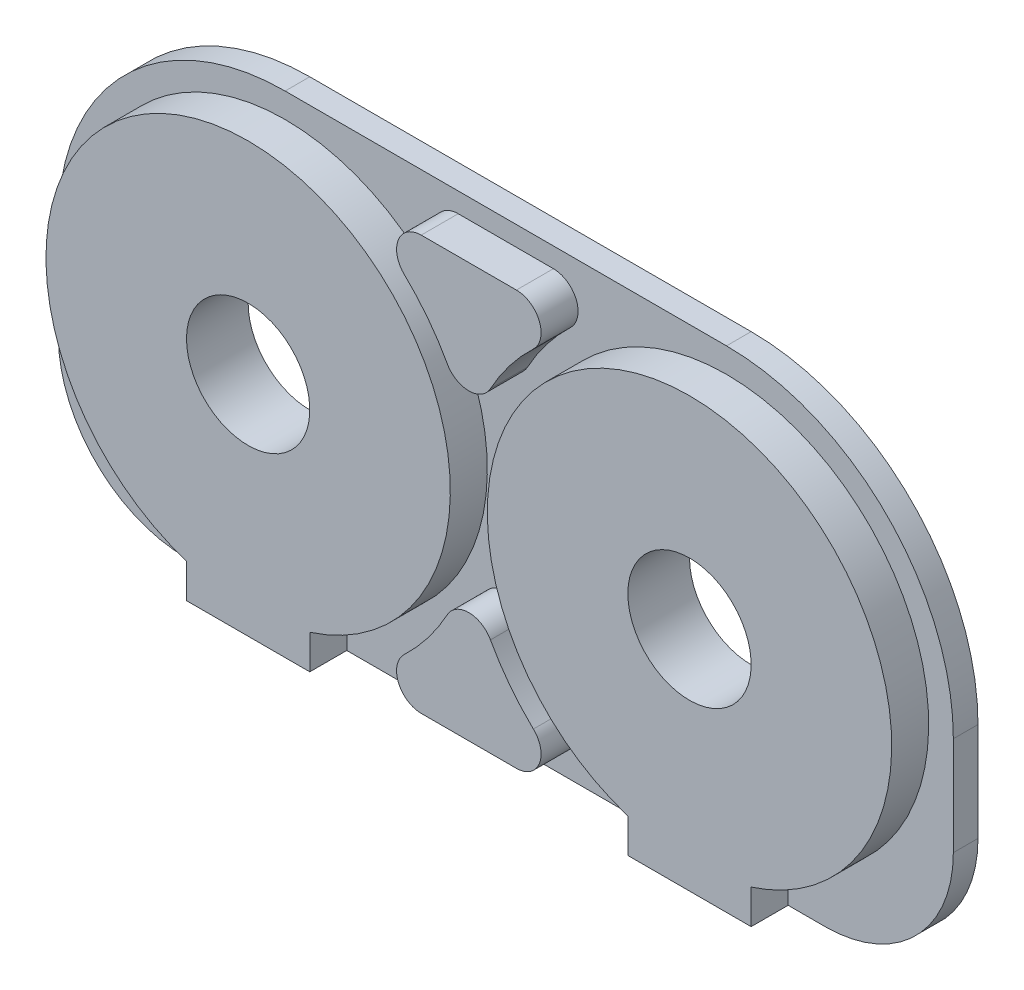
from build123d import *

# Parameters (mm, degrees)
EXTRUDE_1_DEPTH     = 1.5
EXTRUDE_1_2_DEPTH   = 1.5
EXTRUDE_1_3_DEPTH   = 1.5
EXTRUDE_1_4_DEPTH   = 1.5
EXTRUDE_START       = 1
EXTRUDE_2_DEPTH     = 1
SKETCH_4_R          = 2.5
CUT_EXTRUDE_1_DEPTH = 21.501524334


with BuildPart() as part:
    # Эскиз2 → Бобышка-Вытянуть1 (new body)
    with BuildSketch(Plane.XY):
        with BuildLine():
            Line((-1.93002849, -8.4), (1.93002849, -8.4))
            ThreePointArc((1.93002849, -8.4), (2.858869218, -7.770479287), (2.618260991, -6.674509804))
            ThreePointArc((2.618260991, -6.674509804), (1.659625246, -5.611633981), (0.87745098, -4.412930129))
            ThreePointArc((0.87745098, -4.412930129), (0, -3.892596448), (-0.87745098, -4.412930129))
            ThreePointArc((-0.87745098, -4.412930129), (-1.659625246, -5.611633981), (-2.618260991, -6.674509804))
            ThreePointArc((-2.618260991, -6.674509804), (-2.858869218, -7.770479287), (-1.93002849, -8.4))
        make_face()
    extrude(amount=EXTRUDE_1_DEPTH)



with BuildPart() as body_2:
    # Эскиз2 → Extrude 1 2 (new body)
    with BuildSketch(Plane.XY):
        with BuildLine():
            Line((1.93002849, 8.4), (-1.93002849, 8.4))
            ThreePointArc((-1.93002849, 8.4), (-2.858869218, 7.770479287), (-2.618260991, 6.674509804))
            ThreePointArc((-2.618260991, 6.674509804), (-1.659625246, 5.611633981), (-0.87745098, 4.412930129))
            ThreePointArc((-0.87745098, 4.412930129), (0, 3.892596448), (0.87745098, 4.412930129))
            ThreePointArc((0.87745098, 4.412930129), (1.659625246, 5.611633981), (2.618260991, 6.674509804))
            ThreePointArc((2.618260991, 6.674509804), (2.858869218, 7.770479287), (1.93002849, 8.4))
        make_face()
    extrude(amount=EXTRUDE_1_2_DEPTH)


with BuildPart() as body_3:
    # Эскиз2 → Extrude 1 3 (new body)
    with BuildSketch(Plane.XY):
        with BuildLine():
            Line((-11.45, -8.019351595), (-11.45, -7.809609465))
            ThreePointArc((-11.45, -7.809609465), (-8.95, 8.2), (-6.45, -7.809609465))
            Line((-6.45, -7.809609465), (-6.45, -8.019351595))
            Line((-6.45, -8.019351595), (-6.45, -9.2))
            Line((-6.45, -9.2), (-11.45, -9.2))
            Line((-11.45, -9.2), (-11.45, -8.019351595))
        make_face()
    extrude(amount=EXTRUDE_1_3_DEPTH)


with BuildPart() as body_4:
    # Эскиз2 → Extrude 1 4 (new body)
    with BuildSketch(Plane.XY):
        with BuildLine():
            Line((6.45, -8.019351595), (6.45, -7.809609465))
            ThreePointArc((6.45, -7.809609465), (8.95, 8.2), (11.45, -7.809609465))
            Line((11.45, -7.809609465), (11.45, -8.019351595))
            Line((11.45, -8.019351595), (11.45, -9.2))
            Line((11.45, -9.2), (6.45, -9.2))
            Line((6.45, -9.2), (6.45, -8.019351595))
        make_face()
    extrude(amount=EXTRUDE_1_4_DEPTH)


with BuildPart() as part_1:
    add(part.part)

    add(body_2.part)  # Бобышка-Вытянуть2 merges body 2

    add(body_3.part)  # Бобышка-Вытянуть2 merges body 3

    add(body_4.part)  # Бобышка-Вытянуть2 merges body 4
    # Эскиз3 → Бобышка-Вытянуть2 (add)
    with BuildSketch(Plane(origin=(0, 0, 0), x_dir=(-1, 0, 0), z_dir=(0, 0, -1)).offset(EXTRUDE_START)):
        with BuildLine():
            Line((-8.95, 9.2), (8.95, 9.2))
            ThreePointArc((8.95, 9.2), (15.455382387, 6.505382387), (18.15, 0))
            Line((18.15, 0), (18.15, -4))
            ThreePointArc((18.15, -4), (16.626955262, -7.676955262), (12.95, -9.2))
            Line((12.95, -9.2), (11.45, -9.2))
            Line((11.45, -9.2), (6.45, -9.2))
            Line((6.45, -9.2), (-6.45, -9.2))
            Line((-6.45, -9.2), (-11.45, -9.2))
            Line((-11.45, -9.2), (-12.95, -9.2))
            ThreePointArc((-12.95, -9.2), (-16.626955262, -7.676955262), (-18.15, -4))
            Line((-18.15, -4), (-18.15, 0))
            ThreePointArc((-18.15, 0), (-15.455382387, 6.505382387), (-8.95, 9.2))
        make_face()
    extrude(amount=-EXTRUDE_2_DEPTH)

    # Эскиз4 → Вырез-Вытянуть1 (cut, through all)
    with BuildSketch(Plane(origin=(0, 0, -1), x_dir=(-1, 0, 0), z_dir=(0, 0, -1))):
        with Locations((-8.95, 0)):
            Circle(SKETCH_4_R)
        with Locations((8.95, 0)):
            Circle(SKETCH_4_R)
    extrude(amount=-CUT_EXTRUDE_1_DEPTH, mode=Mode.SUBTRACT)


solid = part_1.part
